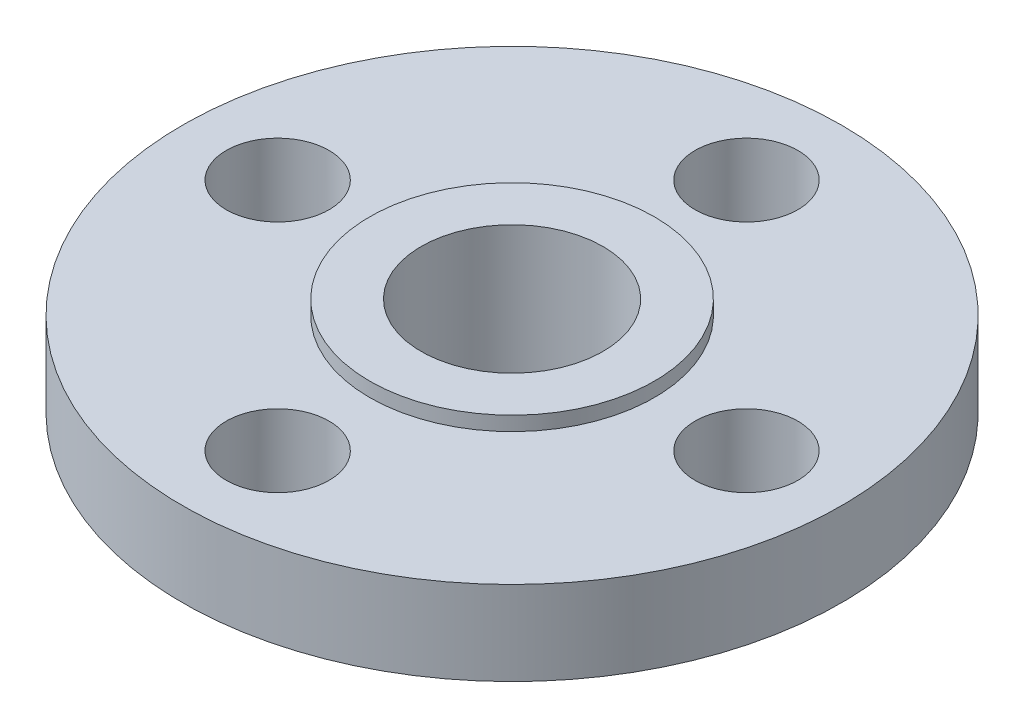
from build123d import *

# Parameters (mm, degrees)
SKETCH2_R          = 9.75
CUT_EXTRUDE1_DEPTH = 92.158049562


with BuildPart() as part:
    # Sketch1 → Revolve1 (revolve)
    with BuildSketch(Plane.XY, mode=Mode.PRIVATE) as revolve1_sk:
        Polygon((-17.25, 0), (-21.459646018, 0), (-23.940788684, 5.845205819), (-27.718503352, 5.845205819), (-30.199646018, 0), (-35, 0), (-35, 6.35), (-62.5, 6.35), (-62.5, 22.3), (-27, 22.3), (-27, 25), (-17.25, 25), align=None)
    revolve(revolve1_sk.sketch.rotate(Axis((0, 0, 0), (0, 1, 0)), 270), axis=Axis((0, 0, 0), (0, 1, 0)))

    # Sketch2 → Cut-Extrude1 (cut, through all)
    with BuildSketch(Plane(origin=(0, 22.3, 0), x_dir=(1, 0, 0), z_dir=(0, 1, 0))):
        with Locations(Location((-44.45, 0, 0), (0, 0, 270))):
            Circle(SKETCH2_R)
        with Locations(Location((0, 44.45, 0), (0, 0, 270))):
            Circle(SKETCH2_R)
        with Locations(Location((44.45, 0, 0), (0, 0, 270))):
            Circle(SKETCH2_R)
        with Locations(Location((0, -44.45, 0), (0, 0, 270))):
            Circle(SKETCH2_R)
    extrude(amount=-CUT_EXTRUDE1_DEPTH, mode=Mode.SUBTRACT)


solid = part.part
